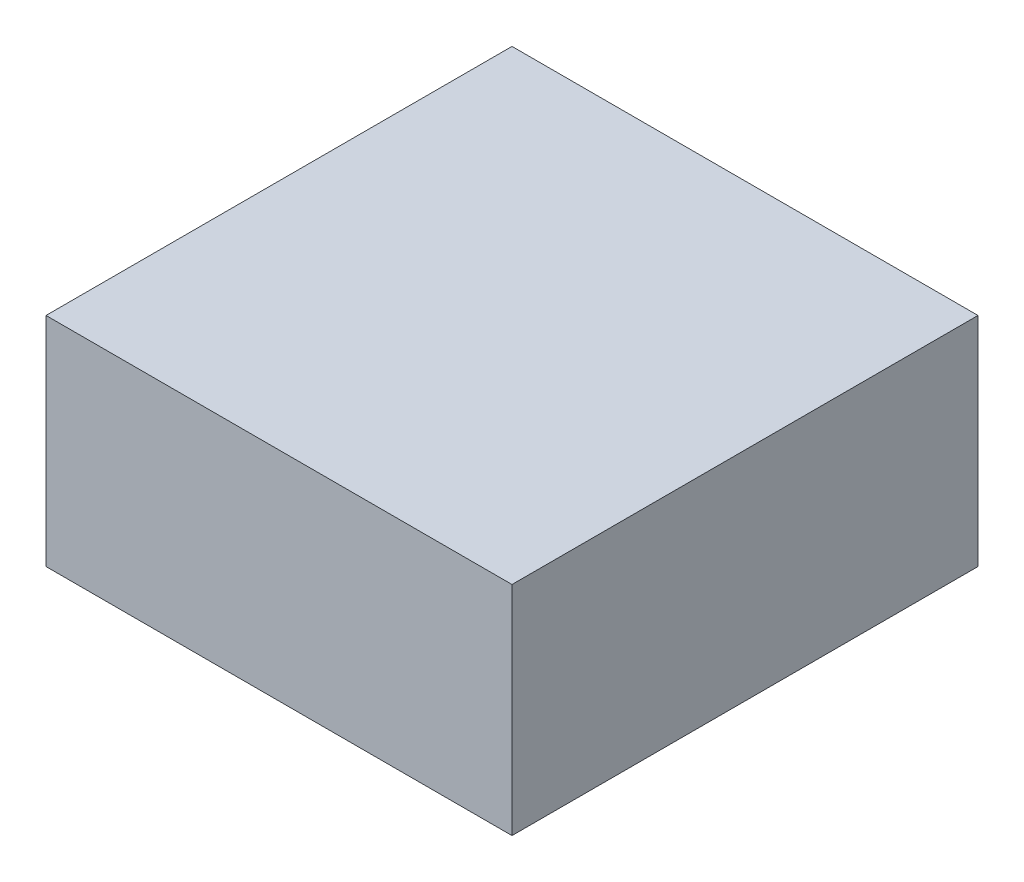
from build123d import *

# Parameters (mm, degrees)
SKETCH1_W           = 150
SKETCH1_H           = 150
BOSS_EXTRUDE1_DEPTH = 70


with BuildPart() as part:
    # Sketch1 → Boss-Extrude1 (new body)
    with BuildSketch(Plane(origin=(0, 0, 0), x_dir=(1, 0, 0), z_dir=(0, 1, 0))):
        Rectangle(SKETCH1_W, SKETCH1_H)
    extrude(amount=BOSS_EXTRUDE1_DEPTH)


solid = part.part
